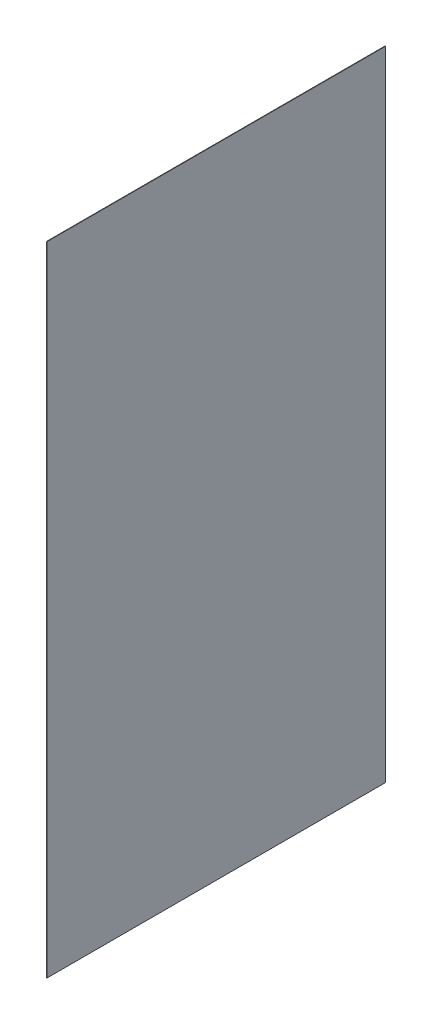
from build123d import *

# Parameters (mm, degrees)
SKETCH1_W                = 1
SKETCH1_H                = 1429.5
STORE_IC_YAN_SOL_1_DEPTH = 758.5


with BuildPart() as part:
    # Sketch1 → STORE_ic_yan_sol_1 (new body)
    with BuildSketch(Plane.XY):
        with Locations((62, 896.25)):
            Rectangle(SKETCH1_W, SKETCH1_H)
    extrude(amount=-STORE_IC_YAN_SOL_1_DEPTH)


solid = part.part
